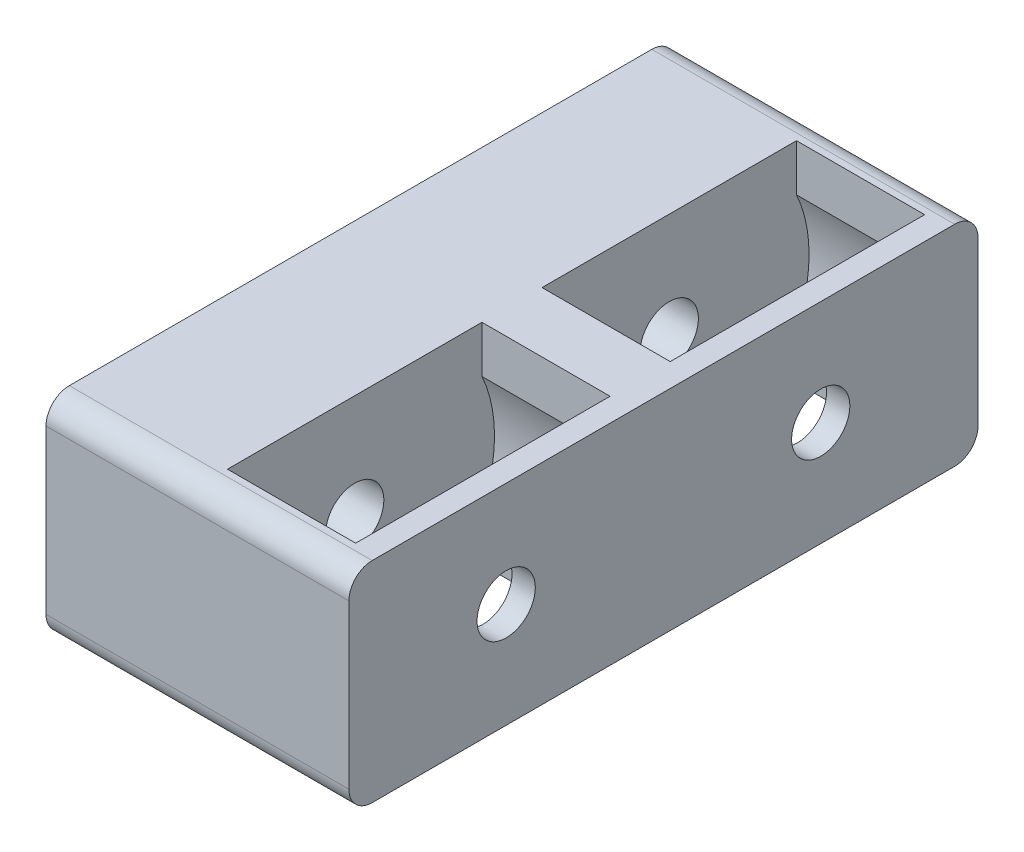
from build123d import *

# Parameters (mm, degrees)
SKETCH_1_R          = 2.5
EXTRUDE_1_DEPTH     = 24
CUT_EXTRUDE_1_DEPTH = 11
SKETCH_3_R          = 2.5
EXTRUDE_2_DEPTH     = 2


with BuildPart() as part:
    # Эскиз1 → Бобышка-Вытянуть1 (new body)
    with BuildSketch(Plane(origin=(0, 0, 0), x_dir=(0, 0, -1), z_dir=(1, 0, 0))):
        with BuildLine():
            Line((-25, 9), (25, 9))
            ThreePointArc((25, 9), (26.414213562, 8.414213562), (27, 7))
            Line((27, 7), (27, -7))
            ThreePointArc((27, -7), (26.414213562, -8.414213562), (25, -9))
            Line((25, -9), (-25, -9))
            ThreePointArc((-25, -9), (-26.414213562, -8.414213562), (-27, -7))
            Line((-27, -7), (-27, 7))
            ThreePointArc((-27, 7), (-26.414213562, 8.414213562), (-25, 9))
        make_face()
        with Locations((-13.5, 0)):
            Circle(SKETCH_1_R, mode=Mode.SUBTRACT)
        with Locations((13.5, 0)):
            Circle(SKETCH_1_R, mode=Mode.SUBTRACT)
    extrude(amount=EXTRUDE_1_DEPTH)

    # Эскиз2 → Вырез-Вытянуть1 (cut)
    with BuildSketch(Plane(origin=(24, 0, 0), x_dir=(0, 0, -1), z_dir=(1, 0, 0))):
        with BuildLine():
            Line((-24.420860707, 9), (-24.420860707, 4.973409436))
            ThreePointArc((-24.420860707, 4.973409436), (-25.5, 0), (-24.420860707, -4.973409436))
            Line((-24.420860707, -4.973409436), (-24.420860707, -9))
            Line((-24.420860707, -9), (-2.579139293, -9))
            Line((-2.579139293, -9), (-2.579139293, -4.973409436))
            ThreePointArc((-2.579139293, -4.973409436), (-1.5, 0), (-2.579139293, 4.973409436))
            Line((-2.579139293, 4.973409436), (-2.579139293, 9))
            Line((-2.579139293, 9), (-24.420860707, 9))
        make_face()
        with BuildLine():
            Line((24.420860707, -4.973409436), (24.420860707, -9))
            Line((24.420860707, -9), (2.579139293, -9))
            Line((2.579139293, -9), (2.579139293, -4.973409436))
            ThreePointArc((2.579139293, -4.973409436), (1.5, 0), (2.579139293, 4.973409436))
            Line((2.579139293, 4.973409436), (2.579139293, 9))
            Line((2.579139293, 9), (24.420860707, 9))
            Line((24.420860707, 9), (24.420860707, 4.973409436))
            ThreePointArc((24.420860707, 4.973409436), (25.5, 0), (24.420860707, -4.973409436))
        make_face()
    extrude(amount=-CUT_EXTRUDE_1_DEPTH, mode=Mode.SUBTRACT)

    # Эскиз3 → Бобышка-Вытянуть2 (add)
    with BuildSketch(Plane(origin=(24, 0, 0), x_dir=(0, 0, -1), z_dir=(1, 0, 0))):
        with BuildLine():
            Line((-25, 9), (25, 9))
            ThreePointArc((25, 9), (26.414213562, 8.414213562), (27, 7))
            Line((27, 7), (27, -7))
            ThreePointArc((27, -7), (26.414213562, -8.414213562), (25, -9))
            Line((25, -9), (-25, -9))
            ThreePointArc((-25, -9), (-26.414213562, -8.414213562), (-27, -7))
            Line((-27, -7), (-27, 7))
            ThreePointArc((-27, 7), (-26.414213562, 8.414213562), (-25, 9))
        make_face()
        with Locations((-13.5, 0)):
            Circle(SKETCH_3_R, mode=Mode.SUBTRACT)
        with Locations((13.5, 0)):
            Circle(SKETCH_3_R, mode=Mode.SUBTRACT)
    extrude(amount=EXTRUDE_2_DEPTH)


solid = part.part
